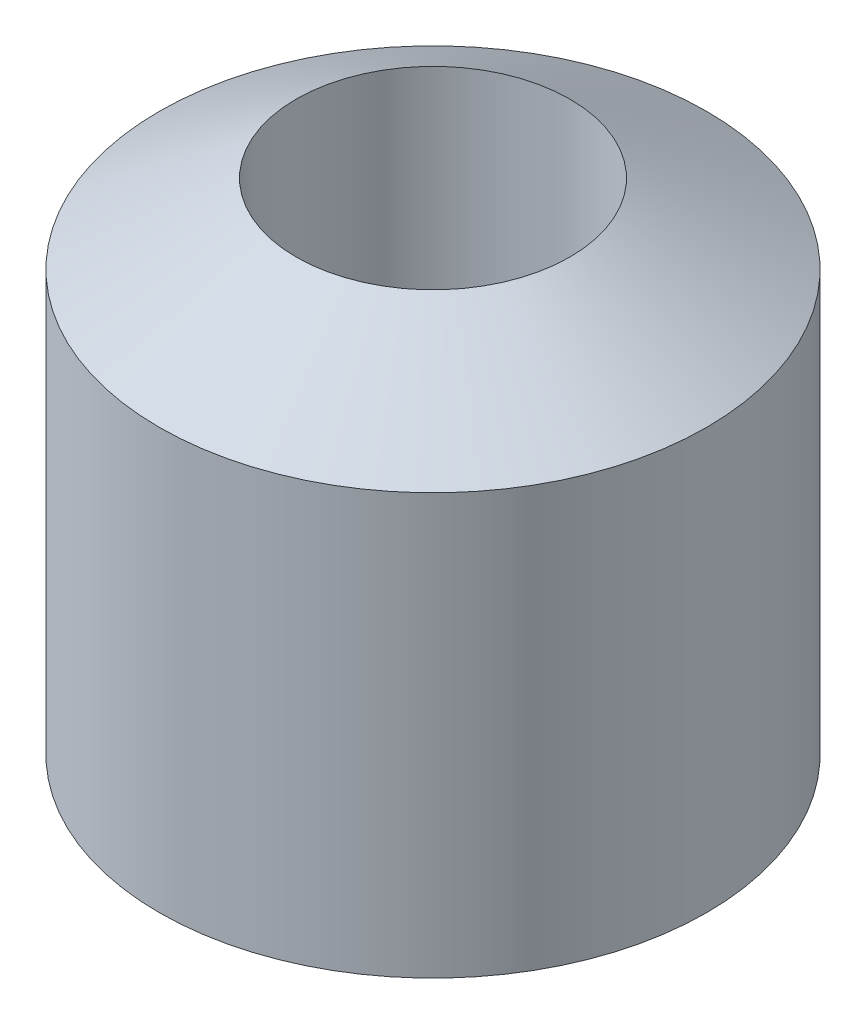
from build123d import *


with BuildPart() as part:
    # Sketch1 → Revolve1 (revolve)
    with BuildSketch(Plane(origin=(0, 0, 0), x_dir=(0, 0, -1), z_dir=(1, 0, 0)), mode=Mode.PRIVATE) as revolve1_sk:
        Polygon((14, -29.582903769), (14, 29.582903769), (28, 21.5), (28, -21.5), align=None)
    revolve(revolve1_sk.sketch.rotate(Axis((0, 129.330769231, 0), (0, -1, 0)), 180), axis=Axis((0, 129.330769231, 0), (0, -1, 0)))


solid = part.part
